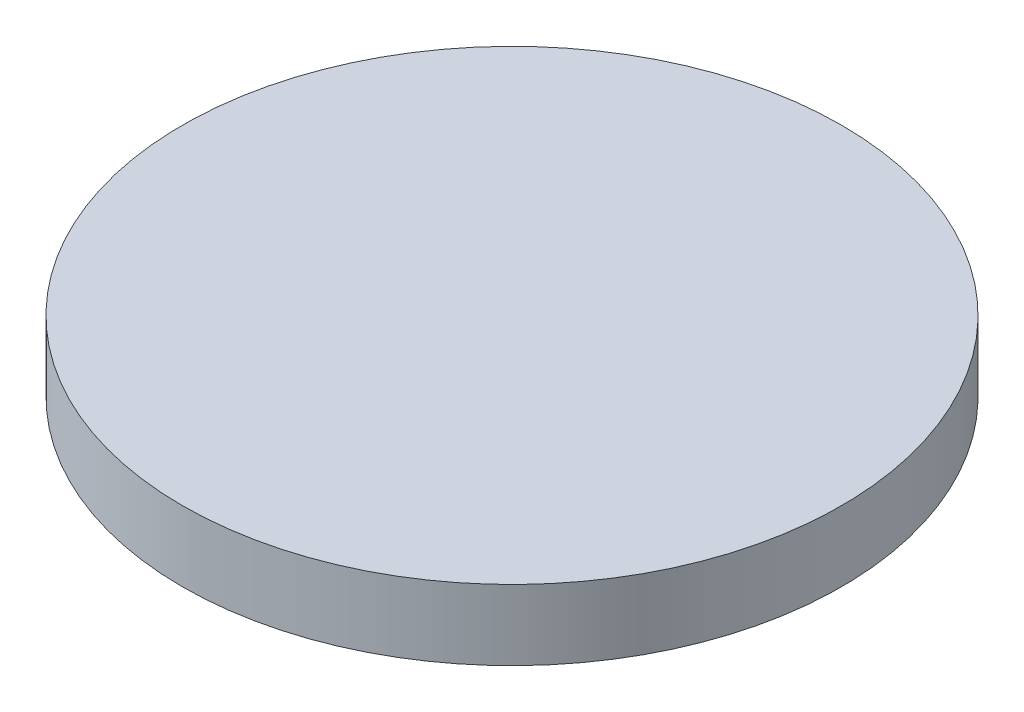
from build123d import *

# Parameters (mm, degrees)
IZIM1_R                     = 15
Y_KSEKLIK_EKSTR_ZYON1_DEPTH = 3.2


with BuildPart() as part:
    # Çizim1 → Yükseklik-Ekstrüzyon1 (new body)
    with BuildSketch(Plane(origin=(0, 0, 0), x_dir=(1, 0, 0), z_dir=(0, 1, 0))):
        with Locations(Location((-10.592335453, -2.180448822, 0), (0, 0, 270))):
            Circle(IZIM1_R)
    extrude(amount=Y_KSEKLIK_EKSTR_ZYON1_DEPTH)


solid = part.part
